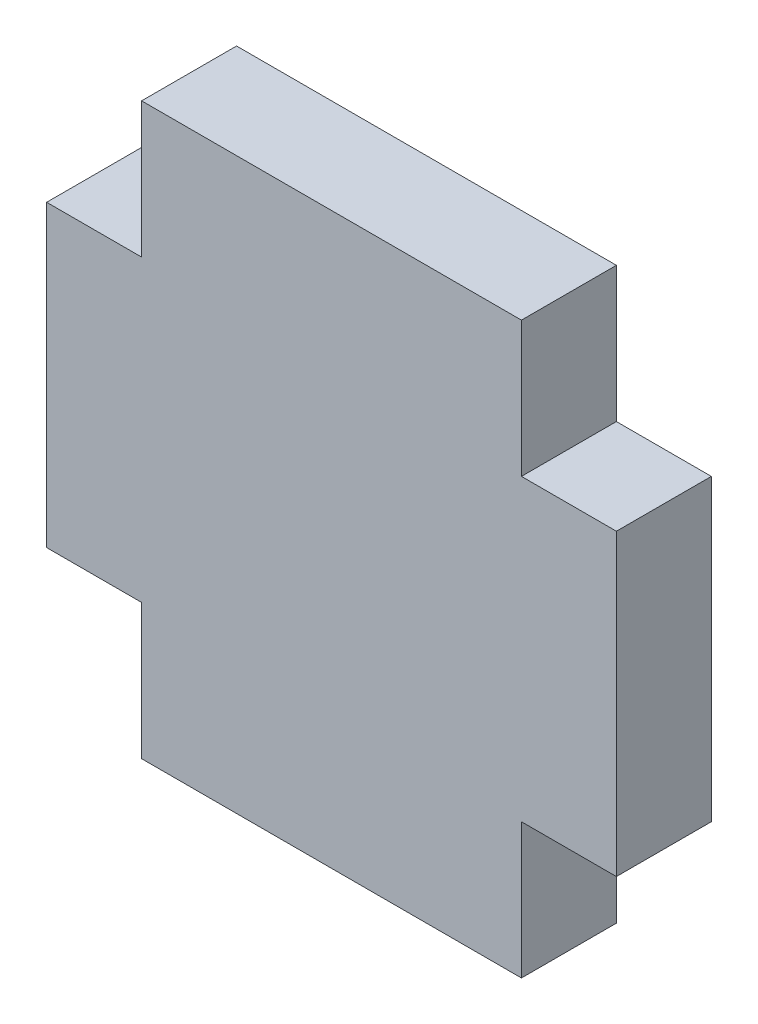
from build123d import *

# Parameters (mm, degrees)
ESQUISSE1_W        = 25.4
ESQUISSE1_H        = 20
ESQUISSE1_W_2      = 6.35
ESQUISSE1_H_2      = 9.05
BOSS_EXTRU_1_DEPTH = 6.35


with BuildPart() as part:
    # Esquisse1 → Boss.-Extru.1 (new body)
    with BuildSketch(Plane.XY):
        Rectangle(ESQUISSE1_W, ESQUISSE1_H)
        with Locations((-15.875, 0)):
            Rectangle(ESQUISSE1_W_2, ESQUISSE1_H)
        with Locations((0, -14.525)):
            Rectangle(ESQUISSE1_W, ESQUISSE1_H_2)
        with Locations((15.875, 0)):
            Rectangle(ESQUISSE1_W_2, ESQUISSE1_H)
        with Locations((0, 14.525)):
            Rectangle(ESQUISSE1_W, ESQUISSE1_H_2)
    extrude(amount=BOSS_EXTRU_1_DEPTH)


solid = part.part
